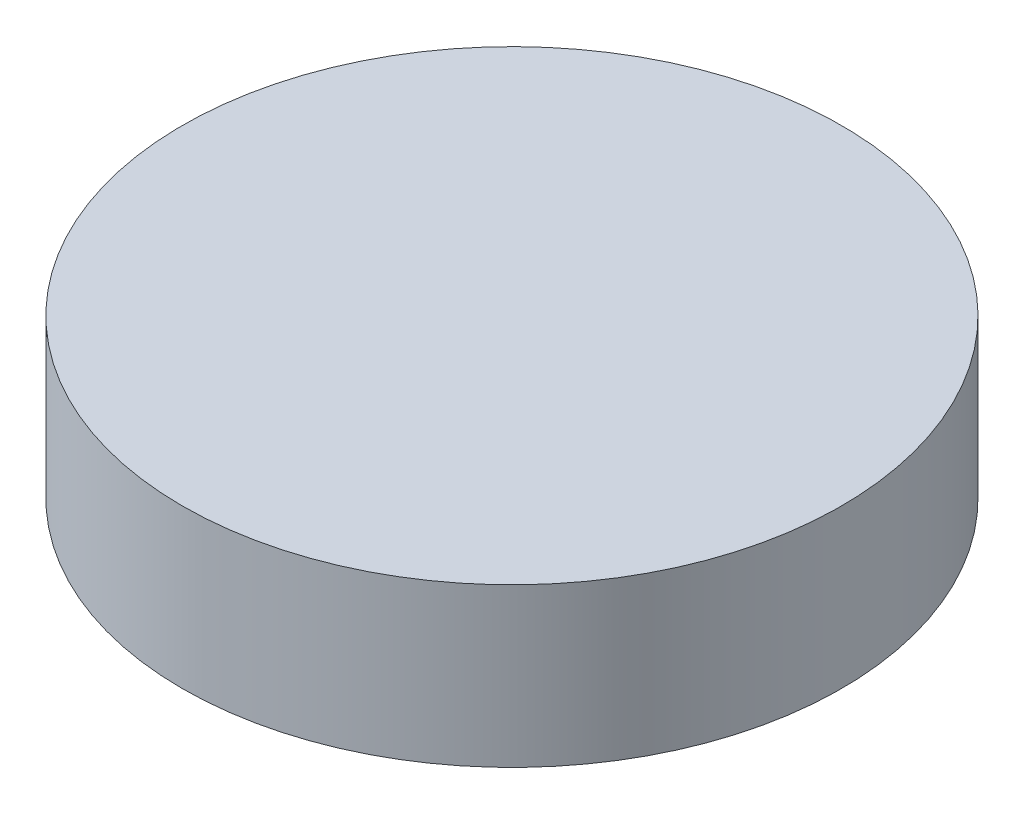
from build123d import *

# Parameters (mm, degrees)
SKETCH1_R               = 25
OVEN_AYAR_AYAGI_2_DEPTH = 12


with BuildPart() as part:
    # Sketch1 → OVEN_ayar_ayagi_2 (new body)
    with BuildSketch(Plane(origin=(0, 0, 0), x_dir=(1, 0, 0), z_dir=(0, 1, 0))):
        with Locations(Location((650, 50, 0), (0, 0, 270))):
            Circle(SKETCH1_R)
    extrude(amount=OVEN_AYAR_AYAGI_2_DEPTH)


solid = part.part
